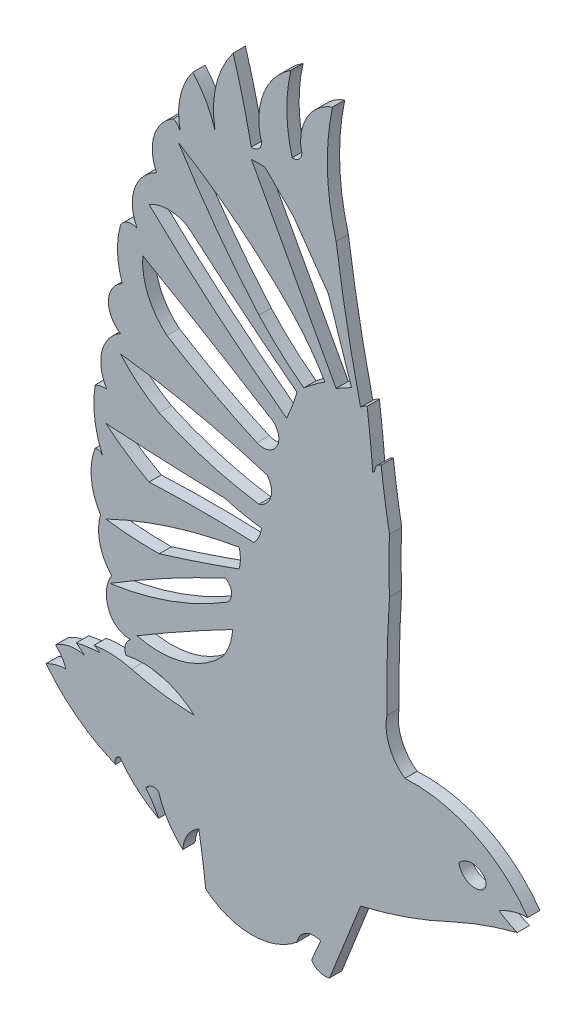
from build123d import *

# Parameters (mm, degrees)
EXTRUDE_1_DEPTH = 0.6


with BuildPart() as part:
    # 스케치1 → 보스-돌출1 (new body)
    with BuildSketch(Plane.XY):
        with BuildLine():
            ThreePointArc((4.030298074, -5.090425762), (7.411693875, -5.758210942), (10.043239009, -7.984136551))
            ThreePointArc((10.043239009, -7.984136551), (9.315192599, -8.101000058), (8.640598378, -8.398710137))
            ThreePointArc((8.640598378, -8.398710137), (9.072165518, -8.665559271), (9.533216798, -8.877432756))
            ThreePointArc((9.533216798, -8.877432756), (7.91223135, -9.377429607), (6.341056677, -10.016961326))
            ThreePointArc((6.341056677, -10.016961326), (4.142570111, -10.922125662), (1.860022651, -11.587439685))
            ThreePointArc((1.860022651, -11.587439685), (1.102716206, -13.492973343), (0.343798468, -15.397865843))
            ThreePointArc((0.343798468, -15.397865843), (-0.148642394, -15.387824962), (-0.537545842, -15.085578489))
            ThreePointArc((-0.537545842, -15.085578489), (-0.322174236, -14.562611208), (-0.088285615, -14.047658959))
            ThreePointArc((-0.088285615, -14.047658959), (-0.822137488, -14.088275826), (-1.255412553, -14.681960101))
            ThreePointArc((-1.255412553, -14.681960101), (-3.494499322, -15.477638269), (-5.722045089, -14.65020056))
            ThreePointArc((-5.722045089, -14.65020056), (-5.873500577, -13.459585236), (-6.056236295, -12.273368025))
            ThreePointArc((-6.056236295, -12.273368025), (-6.609991812, -12.810108614), (-6.839972184, -13.546209599))
            ThreePointArc((-6.839972184, -13.546209599), (-7.564929893, -12.69224696), (-8.029554041, -11.672962763))
            ThreePointArc((-8.029554041, -11.672962763), (-8.375593939, -11.627250809), (-8.647904638, -11.845608492))
            ThreePointArc((-8.647904638, -11.845608492), (-8.302726521, -12.308743549), (-8.029554041, -12.817682455))
            ThreePointArc((-8.029554041, -12.817682455), (-9.074708208, -12.098846989), (-9.931234662, -11.163200637))
            ThreePointArc((-9.931234662, -11.163200637), (-10.129557755, -11.329096098), (-10.140138109, -11.587439685))
            ThreePointArc((-10.140138109, -11.587439685), (-10.210690942, -11.555670475), (-10.280974621, -11.523310169))
            ThreePointArc((-10.280974621, -11.523310169), (-12.069027284, -10.473717558), (-13.537509396, -9.010045034))
            ThreePointArc((-13.537509396, -9.010045034), (-13.069013918, -8.823658657), (-12.570811838, -8.746053354))
            ThreePointArc((-12.570811838, -8.746053354), (-12.636010819, -8.566389785), (-12.727735629, -8.398710137))
            ThreePointArc((-12.727735629, -8.398710137), (-12.888338823, -8.181061427), (-13.073423425, -7.983810224))
            ThreePointArc((-13.073423425, -7.983810224), (-12.386223823, -7.692744879), (-11.64046843, -7.721226847))
            ThreePointArc((-11.64046843, -7.721226847), (-11.850216023, -7.558124303), (-12.049348258, -7.382218516))
            ThreePointArc((-12.049348258, -7.382218516), (-11.485808963, -7.283741079), (-10.916754642, -7.224991428))
            ThreePointArc((-10.916754642, -7.224991428), (-11.042354998, -7.125589513), (-11.186194421, -7.05511675))
            ThreePointArc((-11.186194421, -7.05511675), (-10.263919134, -7.003617145), (-9.351908978, -7.15018245))
            ThreePointArc((-9.351908978, -7.15018245), (-7.834463103, -7.447429106), (-6.293115962, -7.570906017))
            ThreePointArc((-6.293115962, -7.570906017), (-7.854684965, -6.730391458), (-9.627862061, -6.702010806))
            ThreePointArc((-9.627862061, -6.702010806), (-9.649334361, -6.268193502), (-9.390715957, -5.919230706))
            ThreePointArc((-9.390715957, -5.919230706), (-9.995607636, -5.764241089), (-10.41726676, -5.30367697))
            ThreePointArc((-10.41726676, -5.30367697), (-10.585692184, -4.477305932), (-10.324582375, -3.675384562))
            ThreePointArc((-10.324582375, -3.675384562), (-10.903452201, -2.59693172), (-10.868826993, -1.373431863))
            ThreePointArc((-10.868826993, -1.373431863), (-11.320422561, -0.05801749), (-11.135263437, 1.320376367))
            ThreePointArc((-11.135263437, 1.320376367), (-10.938280076, 1.329748585), (-10.781012378, 1.210764745))
            ThreePointArc((-10.781012378, 1.210764745), (-11.157926771, 2.583236589), (-11.135263437, 4.006342275))
            ThreePointArc((-11.135263437, 4.006342275), (-10.85545721, 4.093109731), (-10.563347188, 4.115287442))
            ThreePointArc((-10.563347188, 4.115287442), (-10.803528033, 5.604680775), (-9.8920085, 6.80680867))
            ThreePointArc((-9.8920085, 6.80680867), (-10.481713726, 7.912928367), (-9.803734482, 8.967251459))
            ThreePointArc((-9.803734482, 8.967251459), (-10.039274967, 10.179922402), (-9.8920085, 11.406447055))
            ThreePointArc((-9.8920085, 11.406447055), (-9.539890512, 11.702278994), (-9.08072562, 11.676371182))
            ThreePointArc((-9.08072562, 11.676371182), (-9.205906929, 13.296483466), (-8.125496101, 14.510215981))
            ThreePointArc((-8.125496101, 14.510215981), (-8.247611771, 16.021016433), (-7.301548697, 17.205243989))
            ThreePointArc((-7.301548697, 17.205243989), (-7.104316116, 17.057843024), (-6.969342049, 16.85190678))
            ThreePointArc((-6.969342049, 16.85190678), (-6.968482653, 18.322308426), (-6.351471606, 19.656991573))
            ThreePointArc((-6.351471606, 19.656991573), (-5.700014569, 18.748972195), (-5.260419505, 17.721523101))
            ThreePointArc((-5.260419505, 17.721523101), (-5.214057236, 19.682018167), (-4.376802367, 21.455346858))
            ThreePointArc((-4.376802367, 21.455346858), (-3.892504678, 19.693573733), (-3.487567854, 17.911884938))
            ThreePointArc((-3.487567854, 17.911884938), (-3.066006977, 18.096139572), (-3.041325028, 18.555545866))
            ThreePointArc((-3.041325028, 18.555545866), (-2.85586284, 20.578333187), (-1.550626307, 22.134746488))
            ThreePointArc((-1.550626307, 22.134746488), (-1.748537469, 20.29346107), (-1.489597024, 18.45976244))
            ThreePointArc((-1.489597024, 18.45976244), (-1.095989504, 18.641382864), (-1.058001988, 19.073204363))
            ThreePointArc((-1.058001988, 19.073204363), (-0.725033177, 20.605841008), (0.487220996, 21.600970715))
            ThreePointArc((0.487220996, 21.600970715), (0.237943109, 18.78677332), (0.662219376, 15.993596617))
            ThreePointArc((0.662219376, 15.993596617), (1.189892693, 12.763022093), (1.860022651, 9.558965801))
            ThreePointArc((1.860022651, 9.558965801), (2.009037116, 9.677715241), (2.181597926, 9.758520607))
            ThreePointArc((2.181597926, 9.758520607), (2.336044408, 8.434965252), (2.457138259, 7.10794273))
            ThreePointArc((2.457138259, 7.10794273), (2.514668469, 7.151153984), (2.552974047, 7.212060636))
            ThreePointArc((2.552974047, 7.212060636), (2.64294414, 7.462980854), (2.864657978, 7.610962432))
            ThreePointArc((2.864657978, 7.610962432), (3.049190356, 6.243831639), (3.275326134, 4.882963749))
            ThreePointArc((3.275326134, 4.882963749), (3.243451702, 3.55021098), (3.275326134, 2.217458211))
            ThreePointArc((3.275326134, 2.217458211), (3.164340776, -0.317678635), (3.153561956, -2.85522083))
            ThreePointArc((3.153561956, -2.85522083), (3.261239899, -4.102533088), (4.030298074, -5.090425762))
        make_face()
        Polygon((-3.487567854, 17.402121826), (0.662219376, 9.758520607), (1.417139351, 10.16837418), (0.284183127, 13.580321216), (-1.412674239, 15.993596617), (-2.821211961, 17.402121826), align=None, mode=Mode.SUBTRACT)
        with BuildLine():
            ThreePointArc((6.677664877, -7.339964563), (7.305502408, -7.042001857), (7.933339938, -7.339964563))
            ThreePointArc((7.933339938, -7.339964563), (7.980835553, -7.71788261), (7.708144541, -7.983810224))
            ThreePointArc((7.708144541, -7.983810224), (7.040695534, -7.905499285), (6.677664877, -7.339964563))
        make_face(mode=Mode.SUBTRACT)
        with BuildLine():
            ThreePointArc((-4.400369261, -2.994681507), (-6.760007341, -4.262389223), (-9.08072562, -5.600014505))
            ThreePointArc((-9.08072562, -5.600014505), (-6.796621457, -5.564529666), (-4.85959194, -4.353617755))
            ThreePointArc((-4.85959194, -4.353617755), (-4.541737585, -3.703969422), (-4.400369261, -2.994681507))
        make_face(mode=Mode.SUBTRACT)
        with BuildLine():
            ThreePointArc((-4.672689425, -1.971847504), (-7.436949023, -3.308624535), (-10.41726676, -4.047414179))
            ThreePointArc((-10.41726676, -4.047414179), (-7.629274292, -2.441484932), (-4.754557372, -0.996523558))
            ThreePointArc((-4.754557372, -0.996523558), (-4.452696809, -1.462283552), (-4.672689425, -1.971847504))
        make_face(mode=Mode.SUBTRACT)
        with BuildLine():
            ThreePointArc((-8.799541164, 10.654352658), (-8.547629049, 9.116024972), (-7.62120648, 7.862369114))
            ThreePointArc((-7.62120648, 7.862369114), (-5.457836882, 6.614448168), (-3.213610628, 5.518581739))
            ThreePointArc((-3.213610628, 5.518581739), (-2.202428093, 5.919669726), (-2.60351608, 6.93085226))
            ThreePointArc((-2.60351608, 6.93085226), (-5.684054525, 8.821679922), (-8.799541164, 10.654352658))
        make_face(mode=Mode.SUBTRACT)
        with BuildLine():
            ThreePointArc((-9.8920085, 5.945996607), (-6.266283422, 5.33126828), (-2.709724078, 4.396036287))
            ThreePointArc((-2.709724078, 4.396036287), (-2.530459172, 3.571362631), (-3.111925545, 2.959709622))
            ThreePointArc((-3.111925545, 2.959709622), (-5.609315464, 3.500282971), (-8.00238921, 4.396036287))
            ThreePointArc((-8.00238921, 4.396036287), (-9.011576187, 5.092531438), (-9.8920085, 5.945996607))
        make_face(mode=Mode.SUBTRACT)
        with BuildLine():
            ThreePointArc((-10.611214837, 2.642607999), (-9.591889486, 1.870631516), (-8.496650833, 1.210764745))
            ThreePointArc((-8.496650833, 1.210764745), (-5.930354335, 1.268283464), (-3.364057836, 1.210764745))
            ThreePointArc((-3.364057836, 1.210764745), (-3.113422629, 1.579316891), (-2.989153234, 2.007342369))
            ThreePointArc((-2.989153234, 2.007342369), (-3.892248701, 2.15205972), (-4.778232974, 2.379120067))
            ThreePointArc((-4.778232974, 2.379120067), (-7.696070426, 2.481055337), (-10.611214837, 2.642607999))
        make_face(mode=Mode.SUBTRACT)
        with BuildLine():
            ThreePointArc((-10.611214837, -1.415033335), (-7.421245096, -0.154626123), (-4.087149412, 0.650569046))
            ThreePointArc((-4.087149412, 0.650569046), (-4.021467343, 0.18780093), (-4.087149412, -0.274967185))
            ThreePointArc((-4.087149412, -0.274967185), (-6.034663963, -0.95328213), (-7.998437451, -1.582978708))
            ThreePointArc((-7.998437451, -1.582978708), (-9.308061942, -1.549346316), (-10.611214837, -1.415033335))
        make_face(mode=Mode.SUBTRACT)
        with BuildLine():
            ThreePointArc((-8.496650833, 12.977432433), (-5.218241742, 10.025306663), (-1.760558392, 7.28533612))
            ThreePointArc((-1.760558392, 7.28533612), (-1.478876218, 7.9518294), (-1.255412553, 8.6400315))
            ThreePointArc((-1.255412553, 8.6400315), (-3.948168691, 10.771139092), (-6.579674891, 12.977432433))
            ThreePointArc((-6.579674891, 12.977432433), (-7.538162862, 13.239471032), (-8.496650833, 12.977432433))
        make_face(mode=Mode.SUBTRACT)
        with BuildLine():
            ThreePointArc((-7.047736236, 16.318867687), (-5.189164431, 13.567077376), (-3.111925545, 10.976379077))
            ThreePointArc((-3.111925545, 10.976379077), (-2.064447638, 9.928711142), (-0.920858108, 8.986893191))
            ThreePointArc((-0.920858108, 8.986893191), (-0.415419839, 9.387911427), (0.112720583, 9.758520607))
            ThreePointArc((0.112720583, 9.758520607), (-0.624587445, 10.872523328), (-1.489597024, 11.89055261))
            ThreePointArc((-1.489597024, 11.89055261), (-4.122255687, 14.288475846), (-7.047736236, 16.318867687))
        make_face(mode=Mode.SUBTRACT)
    extrude(amount=EXTRUDE_1_DEPTH)


solid = part.part
